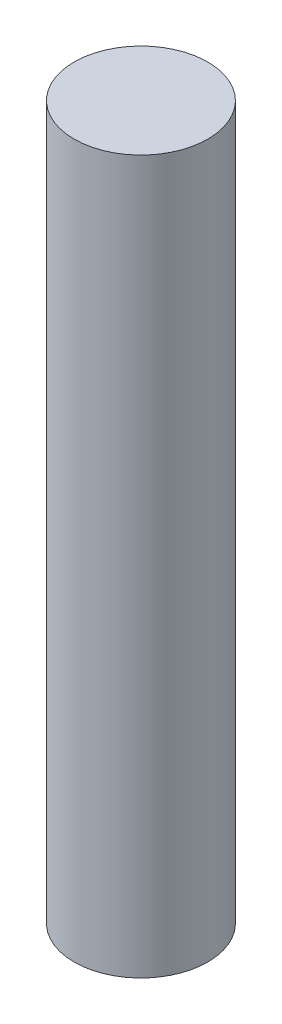
from build123d import *

# Parameters (mm, degrees)
SKETCH1_R           = 4.7625
BOSS_EXTRUDE1_DEPTH = 50.8


with BuildPart() as part:
    # Sketch1 → Boss-Extrude1 (new body)
    with BuildSketch(Plane(origin=(0, 0, 0), x_dir=(1, 0, 0), z_dir=(0, 1, 0))):
        with Locations(Location((0, 0, 0), (0, 0, 270))):
            Circle(SKETCH1_R)
    extrude(amount=BOSS_EXTRUDE1_DEPTH)


solid = part.part
